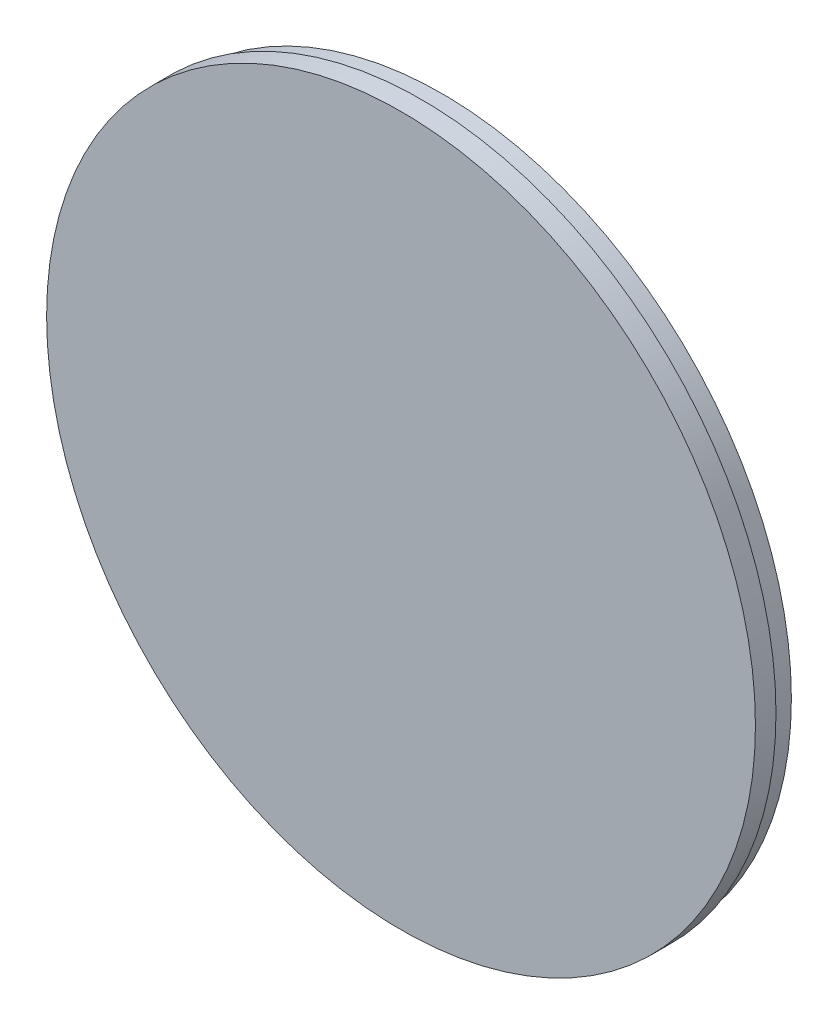
from build123d import *

# Parameters (mm, degrees)
SKETCH1_R           = 17
BOSS_EXTRUDE1_DEPTH = 1
SKETCH2_R           = 17.25
BOSS_EXTRUDE2_DEPTH = 1


with BuildPart() as part:
    # Sketch1 → Boss-Extrude1 (new body)
    with BuildSketch(Plane.XY):
        Circle(SKETCH1_R)
    extrude(amount=BOSS_EXTRUDE1_DEPTH)

    # Sketch2 → Boss-Extrude2 (add)
    with BuildSketch(Plane.XY.offset(1)):
        Circle(SKETCH2_R)
    extrude(amount=BOSS_EXTRUDE2_DEPTH)


solid = part.part
